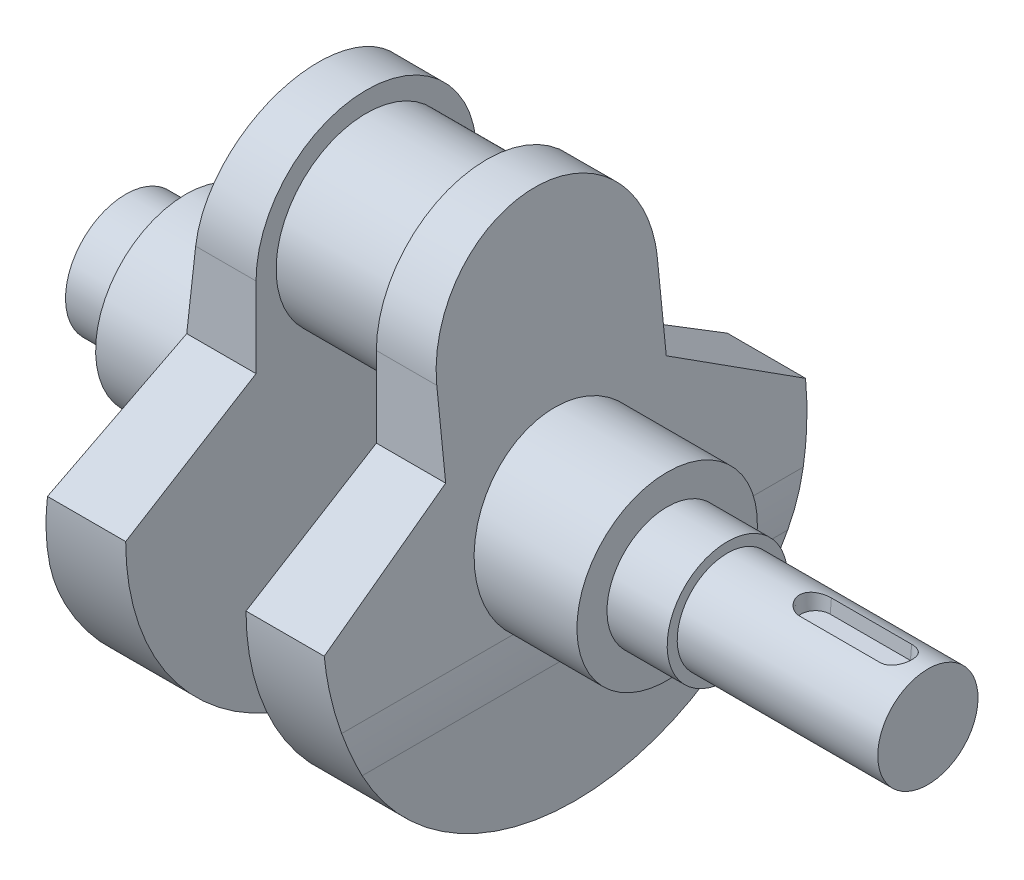
from build123d import *

# Parameters (mm, degrees)
SKETCH1_R               = 22.5
BOSS_EXTRUDE1_DEPTH     = 15
BOSS_EXTRUDE2_DEPTH     = 22
CUT_EXTRUDE1_DEPTH      = 123.347864714
CUT_EXTRUDE1_DEPTH_BACK = 123.347864714
FILLET1_R               = 100
CUT_EXTRUDE2_START      = -27.5
CUT_EXTRUDE2_DEPTH      = 4
CUT_EXTRUDE2_DRAFT      = -5
CUT_EXTRUDE3_DEPTH      = 171.953210139
CUT_EXTRUDE3_DEPTH_BACK = 171.953210139


with BuildPart() as part:
    # Sketch1 → Boss-Extrude1 (new body)
    with BuildSketch(Plane(origin=(0, 0, 0), x_dir=(0, 0, -1), z_dir=(1, 0, 0))):
        Circle(SKETCH1_R)
    extrude(amount=BOSS_EXTRUDE1_DEPTH)

    # Sketch2 → Boss-Extrude2 (add)
    with BuildSketch(Plane(origin=(15, 0, 0), x_dir=(0, 0, -1), z_dir=(1, 0, 0))):
        with BuildLine():
            Line((-27.5, 0), (-27.5, -20))
            Line((-27.5, -20), (-60, -40))
            ThreePointArc((-60, -40), (0, -100), (60, -40))
            Line((60, -40), (27.5, -20))
            Line((27.5, -20), (27.5, 0))
            ThreePointArc((27.5, 0), (0, 27.5), (-27.5, 0))
        make_face()
    extrude(amount=BOSS_EXTRUDE2_DEPTH)

    # Sketch4 → Cut-Extrude1 (cut, two sides: drawn at the far end of the back side and taken through both)
    with BuildSketch(Plane.XY.offset(-CUT_EXTRUDE1_DEPTH_BACK)):
        Polygon((27, 27.5), (37, 27.5), (37, -62.5), align=None)
    extrude(amount=CUT_EXTRUDE1_DEPTH + CUT_EXTRUDE1_DEPTH_BACK, mode=Mode.SUBTRACT)

    # Fillet1
    fillet1_edges = [part.edges().sort_by_distance(p)[0] for p in [
        (37, -62.5, 0),
    ]]
    fillet(fillet1_edges, radius=FILLET1_R)

    # Sketch5 → Revolve1 (revolve)
    with BuildSketch(Plane.XY):
        Polygon((32, -17.5), (60, -17.5), (60, -25), (75, -25), (75, -27.5), (125, -27.5), (125, -40), (32, -40), align=None)
    revolve(axis=Axis((125, -40, 0), (-1, 0, 0)))


with BuildPart() as cut_extrude2_tool:
    # Sketch6 → Cut-Extrude2 (with draft: the straight prism first)
    with BuildSketch(Plane(origin=(0, 0, 0), x_dir=(1, 0, 0), z_dir=(0, 1, 0)).offset(CUT_EXTRUDE2_START)):
        with BuildLine():
            ThreePointArc((97, 4), (93, 0), (97, -4))
            Line((97, -4), (117, -4))
            ThreePointArc((117, -4), (121, 0), (117, 4))
            Line((117, 4), (97, 4))
        make_face()
    extrude(amount=-CUT_EXTRUDE2_DEPTH)
    # Cut-Extrude2: the draft: its side faces are tilted about the plane it starts from
    cut_extrude2_sides = [cut_extrude2_tool.faces().sort_by_distance(p)[0] for p in [
        (107, -29.5, 4),
        (121, -29.5, 0),
        (107, -29.5, -4),
        (93, -29.5, 0),
    ]]
    draft(cut_extrude2_sides, Plane(origin=(0, 0, 0), x_dir=(1, 0, 0), z_dir=(0, 1, 0)).offset(CUT_EXTRUDE2_START), CUT_EXTRUDE2_DRAFT)


with BuildPart() as part_1:
    add(part.part)

    # Cut-Extrude2: cut by cut_extrude2_tool
    add(cut_extrude2_tool.part, mode=Mode.SUBTRACT)

    # Mirror1: part across plane


with BuildPart() as part_2:
    add(part_1.part)
    add(part_1.part.mirror(Plane(origin=(0, 0, 0), x_dir=(0, 0, 1), z_dir=(1, 0, 0))))

    # Sketch7 → Cut-Extrude3 (cut, two sides: drawn at the far end of the back side and taken through both)
    with BuildSketch(Plane.XY.offset(-CUT_EXTRUDE3_DEPTH_BACK)):
        Polygon((-75, -559.039061033), (-75, -87.564181947), (-75, 8.291751842), (-75, 479.766630929), (-1017.949758173, 479.766630929), (-1017.949758173, -559.039061033), align=None)
    extrude(amount=CUT_EXTRUDE3_DEPTH + CUT_EXTRUDE3_DEPTH_BACK, mode=Mode.SUBTRACT)


solid = part_2.part
